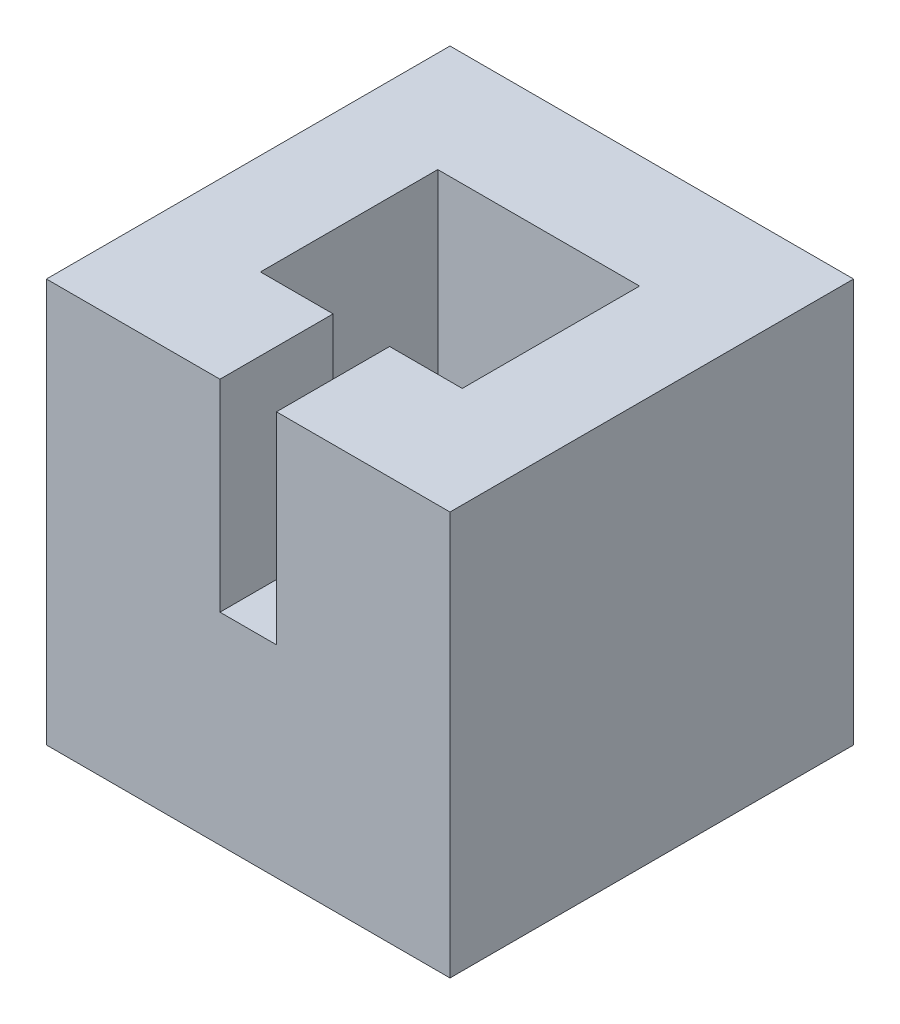
from build123d import *

# Parameters (mm, degrees)
SKETCH1_W           = 12.7
SKETCH1_H           = 12.7
BOSS_EXTRUDE1_DEPTH = 12.7
SKETCH2_W           = 1.778
SKETCH2_H           = 3.560002412
CUT_EXTRUDE1_DEPTH  = 6.35


with BuildPart() as part:
    # Sketch1 → Boss-Extrude1 (new body)
    with BuildSketch(Plane(origin=(0, 0, 0), x_dir=(1, 0, 0), z_dir=(0, 1, 0))):
        Rectangle(SKETCH1_W, SKETCH1_H)
    extrude(amount=BOSS_EXTRUDE1_DEPTH)

    # Sketch2 → Cut-Extrude1 (cut)
    with BuildSketch(Plane(origin=(0, 12.7, 0), x_dir=(1, 0, 0), z_dir=(0, 1, 0))):
        Polygon((-3.175, -2.789997588), (-0.889, -2.789997588), (0.889, -2.789997588), (3.175, -2.789997588), (3.175, 2.789997588), (-3.175, 2.789997588), align=None)
        with Locations((0, -4.569998794)):
            Rectangle(SKETCH2_W, SKETCH2_H)
    extrude(amount=-CUT_EXTRUDE1_DEPTH, mode=Mode.SUBTRACT)


solid = part.part
